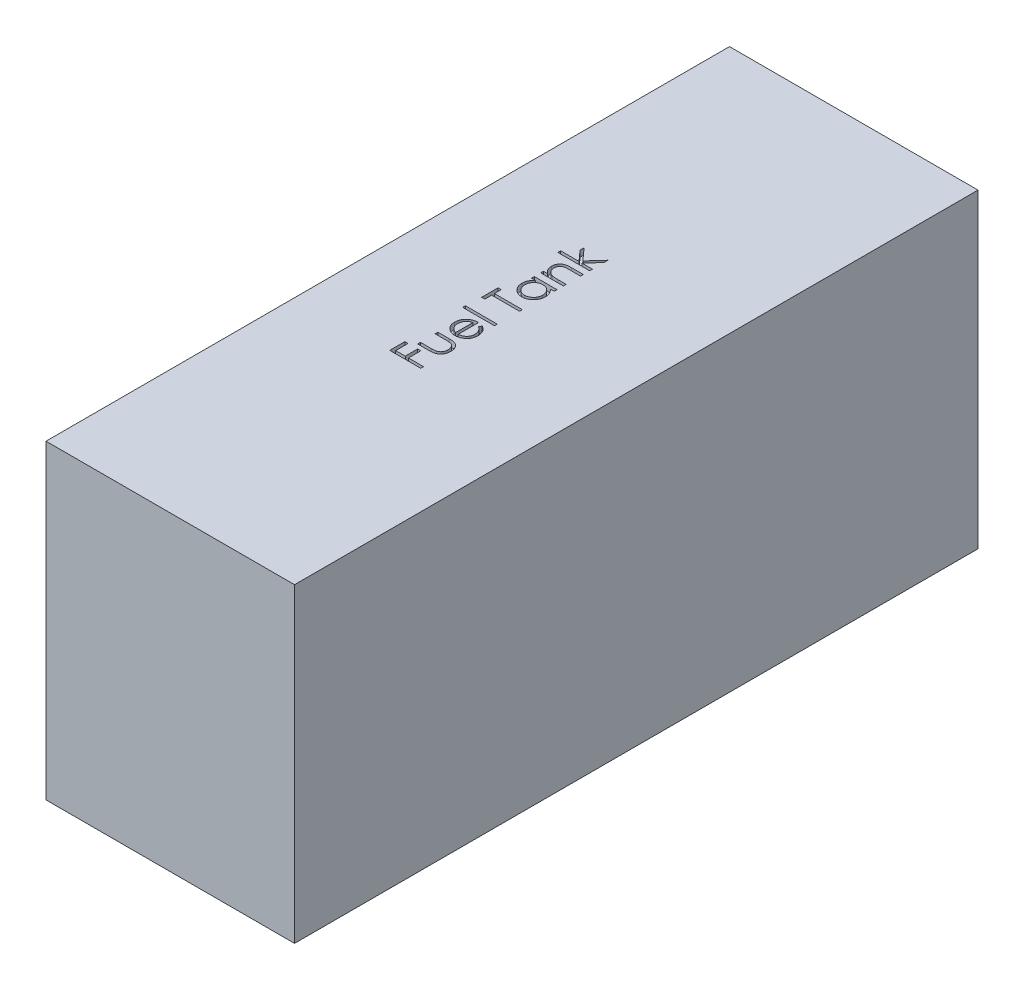
from build123d import *

# Parameters (mm, degrees)
SKETCH1_W           = 80
SKETCH1_H           = 220
BOSS_EXTRUDE1_DEPTH = 100
SKETCH2_W           = 10.256410256
SKETCH2_H           = 0.897435897
CUT_EXTRUDE1_DEPTH  = 2


with BuildPart() as part:
    # Sketch1 → Boss-Extrude1 (new body)
    with BuildSketch(Plane(origin=(0, 0, 0), x_dir=(1, 0, 0), z_dir=(0, 1, 0))):
        Rectangle(SKETCH1_W, SKETCH1_H)
    extrude(amount=BOSS_EXTRUDE1_DEPTH)

    # Sketch2 → Cut-Extrude1 (cut)
    # profile 1 of 8: a face of its own
    with BuildSketch(Plane(origin=(0, 100, 0), x_dir=(1, 0, 0), z_dir=(0, 1, 0))):
        Polygon((-10, -29.358974359), (-10, -24.487179487), (-8.974358974, -24.487179487), (-8.974358974, -28.461538462), (-5.897435897, -28.461538462), (-5.897435897, -24.487179487), (-4.871794872, -24.487179487), (-4.871794872, -28.461538462), (0, -28.461538462), (0, -29.358974359), align=None)
    # profile 2 of 8: a face of its own
    with BuildSketch(Plane(origin=(0, 100, 0), x_dir=(1, 0, 0), z_dir=(0, 1, 0))):
        with BuildLine():
            Line((-7.307692308, -23.076923077), (-7.307692308, -22.179487179))
            Line((-7.307692308, -22.179487179), (-3.918269231, -22.179487179))
            add(Edge.make_bspline(
                [(-3.918269231, -22.179487179), (-3.818775662, -22.179081737), (-3.628449124, -22.178306144), (-3.354577162, -22.173046313), (-3.104815126, -22.160674617), (-2.879018735, -22.145206547), (-2.677226188, -22.125314729), (-2.500142311, -22.101647985), (-2.345758928, -22.075195352), (-2.252777911, -22.049301883), (-2.209535256, -22.037259615)],
                knots=[0, 0, 0, 0, 1.388932606, 2.656963016, 3.823490214, 4.879454478, 5.816252168, 6.653371382, 7.373723809, 8, 8, 8, 8], degree=3))
            add(Edge.make_bspline(
                [(-2.209535256, -22.037259615), (-2.155184196, -22.017941172), (-2.047612022, -21.979705912), (-1.892214864, -21.910353102), (-1.748285486, -21.824557854), (-1.61027385, -21.730672632), (-1.482268173, -21.62238861), (-1.364484619, -21.501075835), (-1.25247293, -21.370795158), (-1.119944953, -21.177209377), (-0.977901153, -20.912468617), (-0.855341672, -20.564889316), (-0.782096472, -20.1880201), (-0.7735986, -19.927549473), (-0.769230769, -19.793669872)],
                knots=[0, 0, 0, 0, 0.725840625, 1.436591201, 2.137033971, 2.831655856, 3.53531722, 4.242432219, 4.957935707, 5.694543706, 7.190802206, 8.724350549, 10.316345118, 12, 12, 12, 12], degree=3))
            add(Edge.make_bspline(
                [(-0.769230769, -19.793669872), (-0.77369148, -19.659802707), (-0.782322129, -19.400794512), (-0.853132239, -19.028066028), (-0.971434207, -18.687347701), (-1.136598241, -18.382059269), (-1.338718421, -18.11358544), (-1.575886446, -17.889858529), (-1.84059898, -17.705266373), (-2.038096919, -17.624668029), (-2.137419872, -17.584134615)],
                knots=[0, 0, 0, 0, 1.157059328, 2.238695713, 3.266970494, 4.264342957, 5.228770407, 6.160125903, 7.074715775, 8, 8, 8, 8], degree=3))
            add(Edge.make_bspline(
                [(-2.137419872, -17.584134615), (-2.177323582, -17.572151101), (-2.265540941, -17.545658477), (-2.415197365, -17.517194616), (-2.593667663, -17.491553297), (-2.802119688, -17.469658508), (-3.040008695, -17.454043757), (-3.307260341, -17.445626539), (-3.603035656, -17.436117181), (-3.810086397, -17.435972849), (-3.918269231, -17.435897436)],
                knots=[0, 0, 0, 0, 0.557542046, 1.232589297, 2.036731608, 2.971723315, 4.038036528, 5.22795436, 6.551621927, 8, 8, 8, 8], degree=3))
            Line((-3.918269231, -17.435897436), (-7.307692308, -17.435897436))
            Line((-7.307692308, -17.435897436), (-7.307692308, -16.538461538))
            Line((-7.307692308, -16.538461538), (-3.75, -16.538461538))
            add(Edge.make_bspline(
                [(-3.75, -16.538461538), (-3.629123041, -16.539728058), (-3.394605206, -16.54218528), (-3.053784292, -16.557858865), (-2.735549962, -16.58512628), (-2.44087579, -16.625444616), (-2.169693326, -16.674358502), (-1.921910512, -16.736203211), (-1.697205203, -16.810465226), (-1.492223291, -16.894182598), (-1.306388703, -16.993117248), (-1.129952383, -17.098290305), (-0.967579022, -17.219961222), (-0.810485502, -17.346945334), (-0.669652589, -17.491521286), (-0.533919322, -17.642566917), (-0.411975288, -17.808386949), (-0.299776937, -17.984168235), (-0.19916331, -18.171566436), (-0.110630408, -18.370125588), (-0.03690342, -18.580645567), (0.023186964, -18.803048623), (0.071185609, -19.036469762), (0.104793038, -19.281382367), (0.125455848, -19.537566133), (0.127273313, -19.712165509), (0.128205128, -19.801682692)],
                knots=[0, 0, 0, 0, 1.493202592, 2.897017285, 4.213619731, 5.437335819, 6.569830554, 7.616136122, 8.589086983, 9.491357706, 10.347307, 11.187612773, 12.025729508, 12.851620453, 13.679855991, 14.515574443, 15.358588344, 16.218977568, 17.089938093, 17.983570823, 18.901874366, 19.842360053, 20.827541903, 21.843594624, 22.894409941, 24, 24, 24, 24], degree=3))
            add(Edge.make_bspline(
                [(0.128205128, -19.801682692), (0.127235894, -19.890530348), (0.125331259, -20.065124264), (0.10490688, -20.321321126), (0.071238187, -20.566912585), (0.022835558, -20.800885575), (-0.03646677, -21.024183138), (-0.111085219, -21.235721187), (-0.199152704, -21.435766847), (-0.299338727, -21.624750535), (-0.412181911, -21.80204526), (-0.536378462, -21.967252529), (-0.668687957, -22.123317561), (-0.813622777, -22.265908197), (-0.97009781, -22.396070277), (-1.137409905, -22.514368096), (-1.313668086, -22.622825014), (-1.502422913, -22.720973311), (-1.709770667, -22.805293342), (-1.939191198, -22.879736683), (-2.193198312, -22.940624287), (-2.471575274, -22.990174177), (-2.772989671, -23.030035442), (-3.099185146, -23.057710132), (-3.449367123, -23.073183935), (-3.691223951, -23.075649825), (-3.816105769, -23.076923077)],
                knots=[0, 0, 0, 0, 1.083759936, 2.129689164, 3.133164553, 4.10615121, 5.04285688, 5.949793092, 6.839814394, 7.707177441, 8.556916231, 9.400895077, 10.227072161, 11.05083587, 11.877976332, 12.707560346, 13.548664154, 14.401248865, 15.299878211, 16.27626931, 17.341250723, 18.483766318, 19.724630785, 21.049282549, 22.476408703, 24, 24, 24, 24], degree=3))
            Line((-3.816105769, -23.076923077), (-7.307692308, -23.076923077))
        make_face()
    # profile 3 of 8: a face of its own
    with BuildSketch(Plane(origin=(0, 100, 0), x_dir=(1, 0, 0), z_dir=(0, 1, 0))):
        with BuildLine():
            Line((-2.307692308, -8.489583333), (-1.889022436, -7.692307692))
            add(Edge.make_bspline(
                [(-1.889022436, -7.692307692), (-1.776353918, -7.755874152), (-1.5571456, -7.879549311), (-1.255962832, -8.09136909), (-0.986627019, -8.315450425), (-0.753451001, -8.558611219), (-0.547527623, -8.813524009), (-0.369907194, -9.085030382), (-0.2173848, -9.370914198), (-0.092406931, -9.674324324), (0.005845295, -9.994897305), (0.078405234, -10.334493332), (0.120483103, -10.694715852), (0.125590092, -10.941395746), (0.128205128, -11.067708333)],
                knots=[0, 0, 0, 0, 1.120611642, 2.180266485, 3.186550691, 4.152466804, 5.095166165, 6.022949561, 6.960161436, 7.899497276, 8.862391909, 9.862399089, 10.905440174, 12, 12, 12, 12], degree=3))
            add(Edge.make_bspline(
                [(0.128205128, -11.067708333), (0.124927484, -11.208113983), (0.118533751, -11.48200473), (0.063412425, -11.880689725), (-0.026508605, -12.256059481), (-0.152124421, -12.60809296), (-0.31620255, -12.935927817), (-0.516086558, -13.240216533), (-0.750751, -13.522555917), (-1.022223298, -13.774061702), (-1.312755251, -14.000442947), (-1.615442705, -14.200338891), (-1.929237421, -14.366680973), (-2.252272389, -14.504058057), (-2.583813544, -14.612422544), (-2.925759662, -14.689428019), (-3.276754826, -14.733408444), (-3.514170851, -14.740178199), (-3.633814103, -14.743589744)],
                knots=[0, 0, 0, 0, 1.14524686, 2.234044844, 3.276713788, 4.290115724, 5.276966211, 6.260758605, 7.254862358, 8.264742877, 9.274005885, 10.257798278, 11.220590477, 12.167824544, 13.118936889, 14.062732937, 15.023735098, 16, 16, 16, 16], degree=3))
            add(Edge.make_bspline(
                [(-3.633814103, -14.743589744), (-3.746085047, -14.740563626), (-3.968591231, -14.734566259), (-4.297921359, -14.696764009), (-4.618002652, -14.629768886), (-4.929101074, -14.537836532), (-5.230695743, -14.419118686), (-5.52297021, -14.273883774), (-5.805613467, -14.101905552), (-5.983908135, -13.969126484), (-6.073717949, -13.90224359)],
                knots=[0, 0, 0, 0, 1.024358464, 2.0301432, 3.019427413, 4.004406732, 4.986367066, 5.972626655, 6.978780325, 8, 8, 8, 8], degree=3))
            add(Edge.make_bspline(
                [(-6.073717949, -13.90224359), (-6.182094117, -13.811806392), (-6.395065251, -13.634087315), (-6.672350462, -13.330382285), (-6.909544255, -13.005954343), (-7.103047421, -12.657540131), (-7.25188195, -12.285726534), (-7.357745982, -11.892431338), (-7.423619418, -11.476567486), (-7.43174254, -11.191488266), (-7.435897436, -11.045673077)],
                knots=[0, 0, 0, 0, 1.030811313, 2.025658015, 2.997072178, 3.962767568, 4.930766827, 5.917075773, 6.934604948, 8, 8, 8, 8], degree=3))
            add(Edge.make_bspline(
                [(-7.435897436, -11.045673077), (-7.432048101, -10.89581416), (-7.424496583, -10.601825125), (-7.353861864, -10.173283665), (-7.243208333, -9.766992504), (-7.081991392, -9.386304556), (-6.882151981, -9.025353981), (-6.629564324, -8.692448015), (-6.337201619, -8.378448173), (-6.112127886, -8.195871359), (-5.997596154, -8.102964744)],
                knots=[0, 0, 0, 0, 1.056389096, 2.072394598, 3.055233004, 4.020130009, 4.981825462, 5.957811105, 6.960805292, 8, 8, 8, 8], degree=3))
            add(Edge.make_bspline(
                [(-5.997596154, -8.102964744), (-5.911300207, -8.03974492), (-5.739282725, -7.913726082), (-5.458793705, -7.755877225), (-5.165334864, -7.618856097), (-4.854162586, -7.509333351), (-4.528963786, -7.420649062), (-4.187413658, -7.356486723), (-3.829613911, -7.318859241), (-3.585823753, -7.311462963), (-3.461538462, -7.307692308)],
                knots=[0, 0, 0, 0, 0.94817472, 1.890038105, 2.849395472, 3.817997239, 4.812318967, 5.836947057, 6.897266129, 8, 8, 8, 8], degree=3))
            Line((-3.461538462, -7.307692308), (-3.461538462, -13.846153846))
            add(Edge.make_bspline(
                [(-3.461538462, -13.846153846), (-3.365251421, -13.841754971), (-3.175906839, -13.833104759), (-2.898847458, -13.792775779), (-2.634923624, -13.729207854), (-2.386114932, -13.639867675), (-2.149171711, -13.531676688), (-1.925851605, -13.399146069), (-1.717171805, -13.241033058), (-1.521265698, -13.064673917), (-1.34680638, -12.86836793), (-1.190658448, -12.661845795), (-1.059785314, -12.442149895), (-0.953557058, -12.211012514), (-0.870396155, -11.968807413), (-0.813630953, -11.715458284), (-0.775610648, -11.451463666), (-0.771383033, -11.271504426), (-0.769230769, -11.179887821)],
                knots=[0, 0, 0, 0, 1.094153842, 2.151609401, 3.174256925, 4.172055639, 5.149267565, 6.128595816, 7.11444997, 8.118368179, 9.117203808, 10.09244225, 11.054858984, 12.015122123, 12.976791628, 13.957293641, 14.960065497, 16, 16, 16, 16], degree=3))
            add(Edge.make_bspline(
                [(-0.769230769, -11.179887821), (-0.770954084, -11.090309205), (-0.774373471, -10.912568047), (-0.808099299, -10.647937456), (-0.861551808, -10.387135112), (-0.938539679, -10.132750712), (-1.028691437, -9.88849159), (-1.134799475, -9.661044681), (-1.255774648, -9.453416947), (-1.39324778, -9.25860456), (-1.561963417, -9.070669112), (-1.770481199, -8.881284799), (-2.021166138, -8.682697015), (-2.208589501, -8.556376911), (-2.307692308, -8.489583333)],
                knots=[0, 0, 0, 0, 0.991168677, 1.966668791, 2.94808785, 3.9350306, 4.905702032, 5.828266021, 6.709360349, 7.562606342, 8.463112863, 9.498839253, 10.677475166, 12, 12, 12, 12], degree=3))
        make_face()
        with BuildLine():
            add(Edge.make_bspline(
                [(-4.358974359, -8.205128205), (-4.478070627, -8.237842686), (-4.70669677, -8.30064386), (-5.023178084, -8.434389873), (-5.306068873, -8.581384299), (-5.550668121, -8.758336664), (-5.768252773, -8.956870429), (-5.955357269, -9.189358268), (-6.127807897, -9.445716917), (-6.271418216, -9.731052522), (-6.38943133, -10.034112869), (-6.47620745, -10.348668871), (-6.527217053, -10.672085834), (-6.534695757, -10.889914996), (-6.538461538, -10.999599359)],
                knots=[0, 0, 0, 0, 1.155085888, 2.217389643, 3.210301801, 4.133263417, 5.03575695, 5.95948047, 6.920061569, 7.923798377, 8.943125483, 9.960783337, 10.973185325, 12, 12, 12, 12], degree=3))
            add(Edge.make_bspline(
                [(-6.538461538, -10.999599359), (-6.536734285, -11.089176028), (-6.533319867, -11.26625027), (-6.500253623, -11.527011572), (-6.447119841, -11.778083951), (-6.368994796, -12.018717968), (-6.273932055, -12.250509835), (-6.157080712, -12.473292066), (-6.015805394, -12.684200754), (-5.907885917, -12.816018386), (-5.853365385, -12.882612179)],
                knots=[0, 0, 0, 0, 1.048823158, 2.073302879, 3.073550078, 4.050623576, 5.03253758, 6.005186856, 6.992227572, 8, 8, 8, 8], degree=3))
            add(Edge.make_bspline(
                [(-5.853365385, -12.882612179), (-5.810243301, -12.930314746), (-5.722974715, -13.026853114), (-5.572534805, -13.155709364), (-5.41021895, -13.280004764), (-5.228941914, -13.390459338), (-5.033960534, -13.495430013), (-4.823852079, -13.591085515), (-4.597729677, -13.678059927), (-4.440081927, -13.726883934), (-4.358974359, -13.752003205)],
                knots=[0, 0, 0, 0, 0.879905587, 1.780714457, 2.708106151, 3.677566983, 4.684151534, 5.740052498, 6.837288539, 8, 8, 8, 8], degree=3))
            Line((-4.358974359, -13.752003205), (-4.358974359, -8.205128205))
        make_face(mode=Mode.SUBTRACT)
    # profile 4 of 8: a face of its own
    with BuildSketch(Plane(origin=(0, 100, 0), x_dir=(1, 0, 0), z_dir=(0, 1, 0))):
        with Locations((-5.128205128, -5.192307693)):
            Rectangle(SKETCH2_W, SKETCH2_H)
    # profile 5 of 8: a face of its own
    with BuildSketch(Plane(origin=(0, 100, 0), x_dir=(1, 0, 0), z_dir=(0, 1, 0))):
        Polygon((-8.974358974, 0.256410256), (-10, 0.256410256), (-10, 5.512820513), (-8.974358974, 5.512820513), (-8.974358974, 3.333333333), (0, 3.333333333), (0, 2.435897436), (-8.974358974, 2.435897436), align=None)
    # profile 6 of 8: a face of its own
    with BuildSketch(Plane(origin=(0, 100, 0), x_dir=(1, 0, 0), z_dir=(0, 1, 0))):
        with BuildLine():
            Line((-7.307692308, 14.487179487), (0, 14.487179487))
            Line((0, 14.487179487), (0, 13.58974359))
            Line((0, 13.58974359), (-1.264022436, 13.58974359))
            add(Edge.make_bspline(
                [(-1.264022436, 13.58974359), (-1.149812095, 13.488389061), (-0.926597727, 13.290300281), (-0.63230977, 12.962572235), (-0.39401729, 12.610862031), (-0.198765475, 12.243995114), (-0.052691526, 11.858377927), (0.051319993, 11.456025969), (0.118145616, 11.036554843), (0.124821874, 10.750120922), (0.128205128, 10.604967949)],
                knots=[0, 0, 0, 0, 1.074325654, 2.099677833, 3.090439787, 4.057542011, 5.018572219, 5.985274637, 6.979019747, 8, 8, 8, 8], degree=3))
            add(Edge.make_bspline(
                [(0.128205128, 10.604967949), (0.124701207, 10.475916652), (0.117791321, 10.221421781), (0.064184739, 9.847052989), (-0.021902752, 9.486789419), (-0.141619579, 9.14029064), (-0.300421926, 8.809798796), (-0.490539778, 8.492484234), (-0.71694215, 8.189990828), (-0.975765088, 7.906929289), (-1.256893622, 7.64626643), (-1.556738042, 7.417519937), (-1.874001768, 7.226796852), (-2.204667921, 7.067310907), (-2.551281977, 6.944464209), (-2.912645314, 6.858825254), (-3.288330667, 6.80528112), (-3.544157876, 6.79837409), (-3.673878205, 6.794871795)],
                knots=[0, 0, 0, 0, 1.033919861, 2.038935746, 3.024066025, 3.998881131, 4.97069526, 5.957263378, 6.95902576, 7.993208707, 9.027059324, 10.027763471, 11.009749337, 11.988697705, 12.965288445, 13.950418724, 14.960734635, 16, 16, 16, 16], degree=3))
            add(Edge.make_bspline(
                [(-3.673878205, 6.794871795), (-3.800917358, 6.798451713), (-4.052066911, 6.805529018), (-4.421434619, 6.858252504), (-4.777201078, 6.946912528), (-5.118220916, 7.07133495), (-5.444906774, 7.230883393), (-5.757489702, 7.424963642), (-6.056830838, 7.653589712), (-6.335891486, 7.917168018), (-6.59366467, 8.202695933), (-6.817690514, 8.50814945), (-7.011167225, 8.825930253), (-7.164462871, 9.160967426), (-7.288488884, 9.508302011), (-7.374297364, 9.871026142), (-7.424861139, 10.247630653), (-7.432183323, 10.503317773), (-7.435897436, 10.633012821)],
                knots=[0, 0, 0, 0, 1.020392517, 2.01726096, 2.990465484, 3.961182959, 4.928053699, 5.906110375, 6.912531644, 7.948652711, 8.985773172, 9.998621852, 10.987621588, 11.969261332, 12.953316658, 13.946091881, 14.958173133, 16, 16, 16, 16], degree=3))
            add(Edge.make_bspline(
                [(-7.435897436, 10.633012821), (-7.431784999, 10.78215245), (-7.423720703, 11.074608225), (-7.356749033, 11.502442475), (-7.243260337, 11.906995332), (-7.089950974, 12.292561514), (-6.881961521, 12.653833802), (-6.626932403, 12.9953095), (-6.314319813, 13.309723688), (-6.077194702, 13.494788966), (-5.955528846, 13.58974359)],
                knots=[0, 0, 0, 0, 1.039007978, 2.037445607, 3.008437381, 3.96246474, 4.921201921, 5.904967172, 6.925065498, 8, 8, 8, 8], degree=3))
            Line((-5.955528846, 13.58974359), (-7.307692308, 13.58974359))
            Line((-7.307692308, 13.58974359), (-7.307692308, 14.487179487))
        make_face()
        with BuildLine():
            add(Edge.make_bspline(
                [(-6.538461538, 10.645032051), (-6.533790007, 10.513851052), (-6.524569148, 10.254920625), (-6.452702647, 9.874754076), (-6.332815292, 9.511154885), (-6.169814384, 9.164688452), (-5.960963703, 8.845016215), (-5.714899038, 8.554303538), (-5.427466912, 8.301514228), (-5.108953696, 8.084116031), (-4.76560428, 7.909593896), (-4.406801648, 7.786095985), (-4.038755328, 7.704797496), (-3.78915194, 7.6964818), (-3.663862179, 7.692307692)],
                knots=[0, 0, 0, 0, 1.031130969, 2.035288524, 3.029955243, 4.035265425, 5.037320146, 6.024362013, 7.021230137, 8.037832003, 9.049975902, 10.039737725, 11.016035826, 12, 12, 12, 12], degree=3))
            add(Edge.make_bspline(
                [(-3.663862179, 7.692307692), (-3.539326882, 7.697657461), (-3.290744423, 7.70833603), (-2.922729694, 7.784316015), (-2.56473247, 7.91345751), (-2.218623945, 8.087743655), (-1.8969985, 8.307700462), (-1.604403762, 8.560249354), (-1.354490104, 8.852360724), (-1.145135933, 9.174891035), (-0.976128016, 9.519517313), (-0.858504593, 9.881891556), (-0.782569993, 10.25525273), (-0.773699801, 10.509116243), (-0.769230769, 10.637019231)],
                knots=[0, 0, 0, 0, 0.979154007, 1.954470061, 2.941101473, 3.965068436, 4.993389179, 5.998216918, 6.996159742, 8.005560442, 9.015493761, 10.005250788, 10.994993882, 12, 12, 12, 12], degree=3))
            add(Edge.make_bspline(
                [(-0.769230769, 10.637019231), (-0.774028314, 10.766848689), (-0.783570154, 11.025066605), (-0.855030059, 11.40678554), (-0.977570935, 11.775956861), (-1.142253196, 12.130062234), (-1.347369191, 12.45961873), (-1.587504611, 12.754397663), (-1.86485989, 13.006603725), (-2.173217825, 13.216583726), (-2.509114907, 13.383108127), (-2.866370028, 13.504868641), (-3.24570834, 13.576058782), (-3.505309208, 13.585118914), (-3.637820513, 13.58974359)],
                knots=[0, 0, 0, 0, 1.01787422, 2.024450869, 3.03297362, 4.061474925, 5.080076323, 6.069755756, 7.033548292, 8.009625779, 8.9862229, 9.964937832, 10.961217871, 12, 12, 12, 12], degree=3))
            add(Edge.make_bspline(
                [(-3.637820513, 13.58974359), (-3.738785743, 13.587001714), (-3.937517267, 13.581604836), (-4.229310174, 13.540374637), (-4.508549391, 13.474789133), (-4.775528503, 13.382371505), (-5.028771404, 13.260967835), (-5.270096433, 13.114545647), (-5.498248466, 12.940530076), (-5.710085811, 12.741722373), (-5.903304275, 12.524107508), (-6.075773534, 12.293837392), (-6.217455742, 12.04818383), (-6.334716518, 11.79127801), (-6.428028375, 11.522674197), (-6.490278928, 11.240186712), (-6.533022703, 10.946818178), (-6.536629505, 10.746686591), (-6.538461538, 10.645032051)],
                knots=[0, 0, 0, 0, 1.050140795, 2.067009409, 3.05949893, 4.030605086, 5.00011959, 5.97591094, 6.962425594, 7.979863591, 8.993523472, 9.986985069, 10.967611495, 11.937549037, 12.921786183, 13.919465291, 14.943216303, 16, 16, 16, 16], degree=3))
        make_face(mode=Mode.SUBTRACT)
    # profile 7 of 8: a face of its own
    with BuildSketch(Plane(origin=(0, 100, 0), x_dir=(1, 0, 0), z_dir=(0, 1, 0))):
        with BuildLine():
            Line((-7.307692308, 16.538461538), (-7.307692308, 17.435897436))
            Line((-7.307692308, 17.435897436), (-5.989583333, 17.435897436))
            add(Edge.make_bspline(
                [(-5.989583333, 17.435897436), (-6.109312727, 17.53155384), (-6.341286868, 17.716886877), (-6.643778847, 18.028705838), (-6.897618005, 18.353840241), (-7.097479845, 18.697570782), (-7.248635852, 19.056360401), (-7.357637146, 19.429191037), (-7.423034247, 19.818080643), (-7.431576141, 20.082551766), (-7.435897436, 20.216346154)],
                knots=[0, 0, 0, 0, 1.127869841, 2.185233117, 3.191641716, 4.159226741, 5.10472073, 6.052603964, 7.014823782, 8, 8, 8, 8], degree=3))
            add(Edge.make_bspline(
                [(-7.435897436, 20.216346154), (-7.43120031, 20.351644755), (-7.422002294, 20.616589497), (-7.340721766, 21.00089699), (-7.212845151, 21.362024754), (-7.031274346, 21.694649822), (-6.807040975, 21.995204013), (-6.545412946, 22.25821916), (-6.246057854, 22.477537666), (-5.966710788, 22.62413248), (-5.718470664, 22.71886315), (-5.50616087, 22.781130303), (-5.269521032, 22.831501711), (-5.009142257, 22.876637793), (-4.723976886, 22.906748185), (-4.414706096, 22.930616378), (-4.081383266, 22.947688606), (-3.850850397, 22.948367739), (-3.731971154, 22.948717949)],
                knots=[0, 0, 0, 0, 1.235846195, 2.420061613, 3.574938557, 4.72781258, 5.870749808, 6.993217613, 8.10690044, 9.251157787, 9.865716151, 10.534141144, 11.271861846, 12.076851687, 12.949307443, 13.892392281, 14.913166647, 16, 16, 16, 16], degree=3))
            Line((-3.731971154, 22.948717949), (0, 22.948717949))
            Line((0, 22.948717949), (0, 22.051282051))
            Line((0, 22.051282051), (-3.4375, 22.051282051))
            add(Edge.make_bspline(
                [(-3.4375, 22.051282051), (-3.536992843, 22.050732313), (-3.727305718, 22.049680757), (-3.999786787, 22.046320691), (-4.246230928, 22.038411255), (-4.467346398, 22.02684009), (-4.662323903, 22.010643381), (-4.832150375, 21.993304509), (-4.975321534, 21.972275009), (-5.061507372, 21.953522404), (-5.100160256, 21.945112179)],
                knots=[0, 0, 0, 0, 1.430803381, 2.736883362, 3.918614142, 4.976458302, 5.92063272, 6.731858525, 7.431260095, 8, 8, 8, 8], degree=3))
            add(Edge.make_bspline(
                [(-5.100160256, 21.945112179), (-5.213702297, 21.914904213), (-5.431654398, 21.856917852), (-5.726783969, 21.710717805), (-5.980087707, 21.530381609), (-6.186356089, 21.306949198), (-6.346930716, 21.046421416), (-6.458260393, 20.748365156), (-6.527913975, 20.415865151), (-6.534847606, 20.181993975), (-6.538461538, 20.060096154)],
                knots=[0, 0, 0, 0, 1.084232, 2.08126119, 3.027460722, 3.945137793, 4.874029258, 5.839697328, 6.874011781, 8, 8, 8, 8], degree=3))
            add(Edge.make_bspline(
                [(-6.538461538, 20.060096154), (-6.537121089, 19.987896356), (-6.534468374, 19.84501482), (-6.507179401, 19.633251319), (-6.464040147, 19.427210701), (-6.400465023, 19.227362034), (-6.322432192, 19.033056709), (-6.228556004, 18.842930929), (-6.112991629, 18.661372246), (-5.983796433, 18.485393017), (-5.840734256, 18.321633946), (-5.689744436, 18.169269384), (-5.528958437, 18.033445915), (-5.360958207, 17.910392703), (-5.18343877, 17.804169055), (-4.998112153, 17.711445956), (-4.804734593, 17.63277254), (-4.670520131, 17.593679133), (-4.603365385, 17.57411859)],
                knots=[0, 0, 0, 0, 1.023827899, 2.026128959, 3.023898047, 4.006668367, 4.997079741, 5.992687789, 7.009920206, 8.046337072, 9.087246971, 10.092051999, 11.086713115, 12.070168086, 13.043348831, 14.017773728, 15.008185103, 16, 16, 16, 16], degree=3))
            add(Edge.make_bspline(
                [(-4.603365385, 17.57411859), (-4.554064804, 17.562862451), (-4.44674002, 17.538358426), (-4.270613108, 17.511892197), (-4.066870322, 17.487870553), (-3.835749416, 17.467764957), (-3.576441202, 17.455463767), (-3.290053094, 17.442051205), (-2.975443127, 17.437168174), (-2.756409719, 17.436332876), (-2.642227564, 17.435897436)],
                knots=[0, 0, 0, 0, 0.615963638, 1.340920617, 2.168419149, 3.115676021, 4.16674242, 5.331190069, 6.6087489, 8, 8, 8, 8], degree=3))
            Line((-2.642227564, 17.435897436), (0, 17.435897436))
            Line((0, 17.435897436), (0, 16.538461538))
            Line((0, 16.538461538), (-7.307692308, 16.538461538))
        make_face()
    # profile 8 of 8: a face of its own
    with BuildSketch(Plane(origin=(0, 100, 0), x_dir=(1, 0, 0), z_dir=(0, 1, 0))):
        Polygon((-10.256410256, 25), (-10.256410256, 25.897435897), (-4.326923077, 25.897435897), (-7.307692308, 29.22275641), (-7.307692308, 30.512820513), (-3.846153846, 26.654647436), (0, 30.897435897), (0, 29.609375), (-3.367387821, 25.897435897), (0, 25.897435897), (0, 25), align=None)
    extrude(amount=-CUT_EXTRUDE1_DEPTH, mode=Mode.SUBTRACT)


solid = part.part
